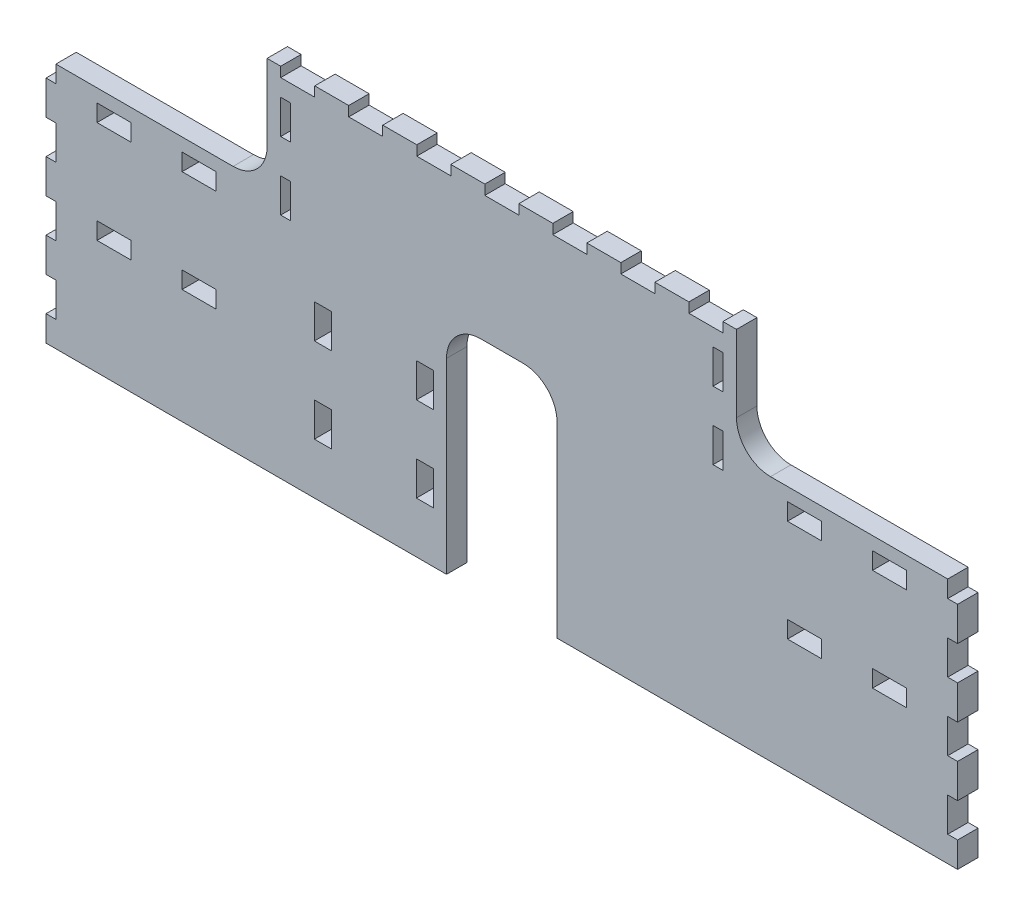
from build123d import *

# Parameters (mm, degrees)
BOSS_EXTRUDE1_DEPTH     = 6
CUT_EXTRUDE1_DEPTH      = 150.053681605
CUT_EXTRUDE1_DEPTH_BACK = 150.053681605
SKETCH2_W               = 10
SKETCH2_H               = 5
SKETCH2_W_2             = 5
SKETCH2_H_2             = 10
FILLET1_R               = 10
CUT_EXTRUDE2_DEPTH      = 150.053681605
CUT_EXTRUDE2_DEPTH_BACK = 150.053681605
SKETCH3_W               = 10
SKETCH3_H               = 2.9
SKETCH3_W_2             = 2.9
SKETCH3_H_2             = 10
SKETCH4_W               = 2.9
SKETCH4_H               = 10
CUT_EXTRUDE3_DEPTH      = 150.053681605


with BuildPart() as part:
    # Sketch1 → Boss-Extrude1 (new body)
    with BuildSketch(Plane.XY):
        Polygon((134, -65), (16.25, -65), (16.25, 0), (-16.25, 0), (-16.25, -65), (-134, -65), (-134, 7.5), (-69, 7.5), (-69, 40), (69, 40), (69, 7.5), (134, 7.5), align=None)
    extrude(amount=-BOSS_EXTRUDE1_DEPTH)

    # Sketch2 → Cut-Extrude1 (cut, two sides: drawn at the far end of the back side and taken through both)
    with BuildSketch(Plane.XY.offset(-CUT_EXTRUDE1_DEPTH_BACK)):
        with Locations((-114, 1.15)):
            Rectangle(SKETCH2_W, SKETCH2_H)
        with Locations((-114, -28.85)):
            Rectangle(SKETCH2_W, SKETCH2_H)
        with Locations((-89, -28.85)):
            Rectangle(SKETCH2_W, SKETCH2_H)
        with Locations((-89, 1.15)):
            Rectangle(SKETCH2_W, SKETCH2_H)
        with Locations((-52.6, -20)):
            Rectangle(SKETCH2_W_2, SKETCH2_H_2)
        with Locations((-22.6, -20)):
            Rectangle(SKETCH2_W_2, SKETCH2_H_2)
        with Locations((-52.6, -45)):
            Rectangle(SKETCH2_W_2, SKETCH2_H_2)
        with Locations((-22.6, -45)):
            Rectangle(SKETCH2_W_2, SKETCH2_H_2)
        with Locations((89, -28.85)):
            Rectangle(SKETCH2_W, SKETCH2_H)
        with Locations((114, -28.85)):
            Rectangle(SKETCH2_W, SKETCH2_H)
        with Locations((114, 1.15)):
            Rectangle(SKETCH2_W, SKETCH2_H)
        with Locations((89, 1.15)):
            Rectangle(SKETCH2_W, SKETCH2_H)
    extrude(amount=CUT_EXTRUDE1_DEPTH + CUT_EXTRUDE1_DEPTH_BACK, mode=Mode.SUBTRACT)

    # Fillet1
    fillet1_edges = [part.edges().sort_by_distance(p)[0] for p in [
        (16.25, 0, -3),
        (-16.25, 0, -3),
        (-69, 7.5, -3),
        (69, 7.5, -3),
    ]]
    fillet(fillet1_edges, radius=FILLET1_R)

    # Sketch3 → Cut-Extrude2 (cut, two sides: drawn at the far end of the back side and taken through both)
    with BuildSketch(Plane(origin=(0, 0, -6), x_dir=(-1, 0, 0), z_dir=(0, 0, -1)).offset(-CUT_EXTRUDE2_DEPTH_BACK)):
        with Locations((0, 38.55)):
            Rectangle(SKETCH3_W, SKETCH3_H)
        with Locations((20, 38.55)):
            Rectangle(SKETCH3_W, SKETCH3_H)
        with Locations((40, 38.55)):
            Rectangle(SKETCH3_W, SKETCH3_H)
        with Locations((60, 38.55)):
            Rectangle(SKETCH3_W, SKETCH3_H)
        with Locations((-20, 38.55)):
            Rectangle(SKETCH3_W, SKETCH3_H)
        with Locations((-40, 38.55)):
            Rectangle(SKETCH3_W, SKETCH3_H)
        with Locations((-60, 38.55)):
            Rectangle(SKETCH3_W, SKETCH3_H)
        with Locations((-132.55, -12.5)):
            Rectangle(SKETCH3_W_2, SKETCH3_H_2)
        with Locations((-132.55, 7.5)):
            Rectangle(SKETCH3_W_2, SKETCH3_H_2)
        with Locations((-132.55, -32.5)):
            Rectangle(SKETCH3_W_2, SKETCH3_H_2)
        with Locations((-132.55, -52.5)):
            Rectangle(SKETCH3_W_2, SKETCH3_H_2)
        with Locations((132.55, -52.5)):
            Rectangle(SKETCH3_W_2, SKETCH3_H_2)
        with Locations((132.55, -32.5)):
            Rectangle(SKETCH3_W_2, SKETCH3_H_2)
        with Locations((132.55, -12.5)):
            Rectangle(SKETCH3_W_2, SKETCH3_H_2)
        with Locations((132.55, 7.5)):
            Rectangle(SKETCH3_W_2, SKETCH3_H_2)
    extrude(amount=CUT_EXTRUDE2_DEPTH + CUT_EXTRUDE2_DEPTH_BACK, mode=Mode.SUBTRACT)

    # Sketch4 → Cut-Extrude3 (cut, through all)
    with BuildSketch(Plane(origin=(0, 0, -6), x_dir=(-1, 0, 0), z_dir=(0, 0, -1))):
        with Locations((63.55, 27.1)):
            Rectangle(SKETCH4_W, SKETCH4_H)
        with Locations((63.55, 7.1)):
            Rectangle(SKETCH4_W, SKETCH4_H)
        with Locations((-63.55, 7.1)):
            Rectangle(SKETCH4_W, SKETCH4_H)
        with Locations((-63.55, 27.1)):
            Rectangle(SKETCH4_W, SKETCH4_H)
    extrude(amount=-CUT_EXTRUDE3_DEPTH, mode=Mode.SUBTRACT)


solid = part.part
